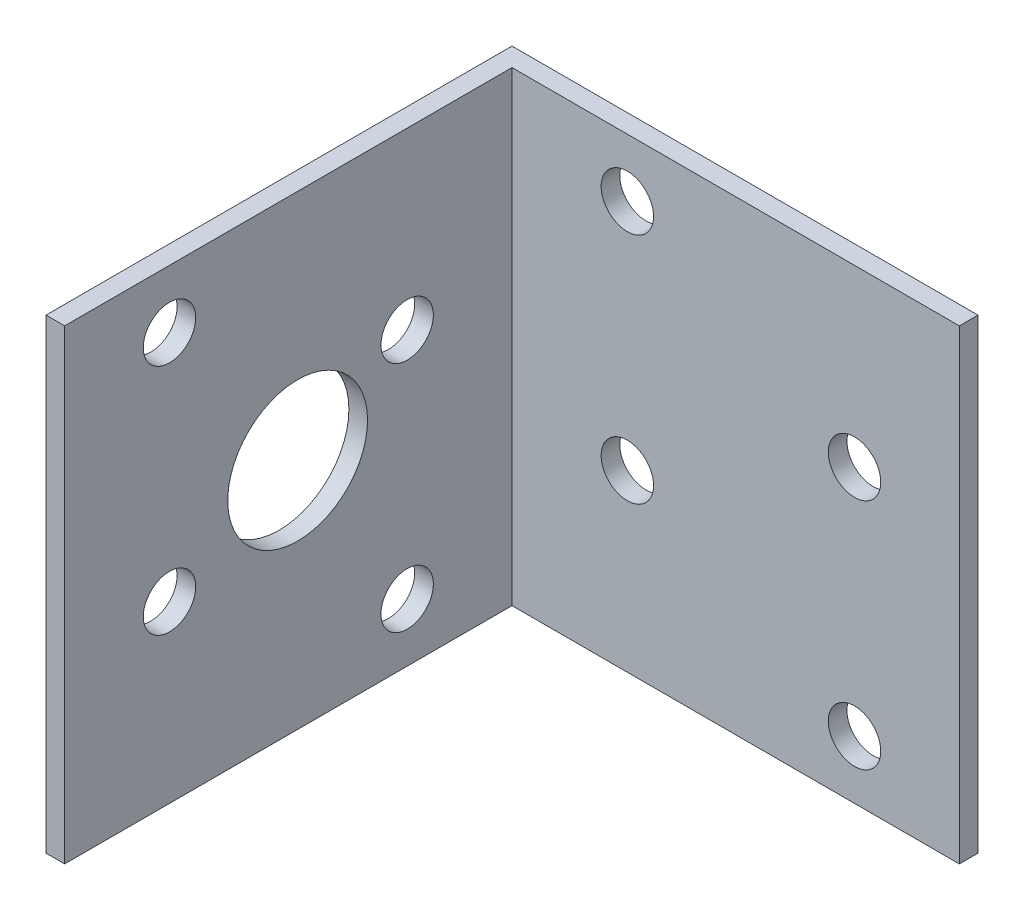
from build123d import *

# Parameters (mm, degrees)
SKETCH_1_W              = 40
SKETCH_1_H              = 40
EXTRUDE_1_DEPTH         = 40
SKETCH_2_W              = 38.4
SKETCH_2_H              = 38.4
CUT_EXTRUDE_1_DEPTH     = 70.282032303
HOLE_WIZARD_4_5_4_5_1_D = 4.5
HOLE_WIZARD_12_0_12_1_D = 12
HOLE_WIZARD_4_5_4_5_2_D = 4.5


with BuildPart() as part:
    # Эскиз1 → Бобышка-Вытянуть1 (new body)
    with BuildSketch(Plane(origin=(40, 0, 0), x_dir=(0, 0, -1), z_dir=(1, 0, 0))):
        with Locations((-20, -20)):
            Rectangle(SKETCH_1_W, SKETCH_1_H)
    extrude(amount=-EXTRUDE_1_DEPTH)

    # Эскиз2 → Вырез-Вытянуть1 (cut, through all)
    with BuildSketch(Plane(origin=(0, 0, 0), x_dir=(-1, 0, 0), z_dir=(0, 1, 0))):
        with Locations((-20.8, 20.8)):
            Rectangle(SKETCH_2_W, SKETCH_2_H)
    extrude(amount=-CUT_EXTRUDE_1_DEPTH, mode=Mode.SUBTRACT)

    # Диаметр отверстия Ø4.5 (4.5)1 (through all)
    with Locations(Plane.XY.offset(1.6)):
        with Locations((31, -15), (11.5, -5), (11.5, -25), (31, -35)):
            Hole(HOLE_WIZARD_4_5_4_5_1_D / 2)

    # Диаметр отверстия Ø12.0 (12)1 (through all)
    with Locations(Plane(origin=(1.6, 0, 0), x_dir=(0, 0, -1), z_dir=(1, 0, 0))):
        with Locations((-20, -20)):
            Hole(HOLE_WIZARD_12_0_12_1_D / 2)

    # Диаметр отверстия Ø4.5 (4.5)2 (through all)
    with Locations(Plane(origin=(1.6, 0, 0), x_dir=(0, 0, -1), z_dir=(1, 0, 0))):
        with Locations((-31, -25), (-10.6, -15), (-10.6, -35), (-31, -5)):
            Hole(HOLE_WIZARD_4_5_4_5_2_D / 2)


solid = part.part
